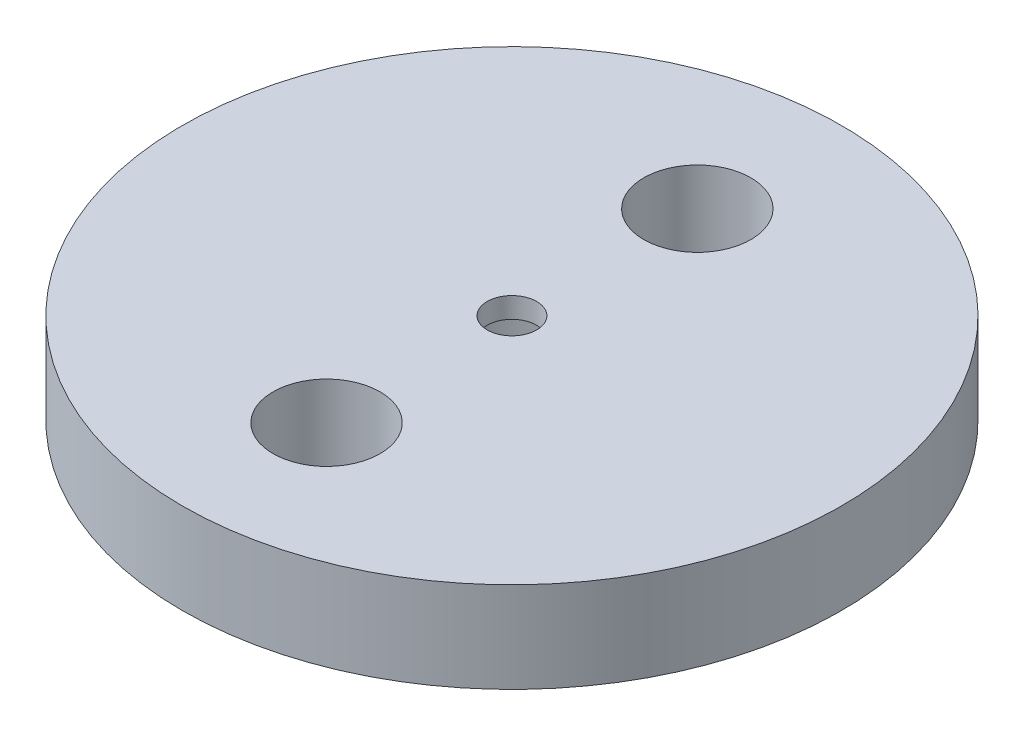
from build123d import *

# Parameters (mm, degrees)
SKETCH1_R           = 8
BOSS_EXTRUDE1_DEPTH = 2.2
SKETCH2_R           = 1.3
CUT_EXTRUDE1_DEPTH  = 2.2
SKETCH3_R           = 3
SKETCH3_R_2         = 2.45
BOSS_EXTRUDE2_DEPTH = 2.2
SKETCH8_R           = 0.6
CUT_EXTRUDE7_DEPTH  = 2.2
CUT_EXTRUDE8_START  = -1.7
SKETCH9_R           = 2.45
CUT_EXTRUDE8_DEPTH  = 1.7


with BuildPart() as part:
    # Sketch1 → Boss-Extrude1 (new body)
    with BuildSketch(Plane(origin=(0, 0, 0), x_dir=(1, 0, 0), z_dir=(0, 1, 0))):
        with Locations(Location((0, 0, 0), (0, 0, 270))):
            Circle(SKETCH1_R)
    extrude(amount=BOSS_EXTRUDE1_DEPTH)

    # Sketch2 → Cut-Extrude1 (cut)
    with BuildSketch(Plane(origin=(0, 2.2, 0), x_dir=(1, 0, 0), z_dir=(0, 1, 0))):
        with Locations(Location((0, 4.5, 0), (0, 0, 270))):
            Circle(SKETCH2_R)
        with Locations(Location((0, -4.5, 0), (0, 0, 90))):
            Circle(SKETCH2_R)
    extrude(amount=-CUT_EXTRUDE1_DEPTH, mode=Mode.SUBTRACT)

    # Sketch3 → Boss-Extrude2 (add)
    with BuildSketch(Plane.XZ):
        with Locations(Location((0, 0, 0), (0, 0, 90))):
            Circle(SKETCH3_R)
        with Locations(Location((0, 0, 0), (0, 0, 270))):
            Circle(SKETCH3_R_2, mode=Mode.SUBTRACT)
    extrude(amount=BOSS_EXTRUDE2_DEPTH)

    # Sketch8 → Cut-Extrude7 (cut)
    with BuildSketch(Plane.XZ):
        with Locations(Location((0, 0, 0), (0, 0, 270))):
            Circle(SKETCH8_R)
    extrude(amount=-CUT_EXTRUDE7_DEPTH, mode=Mode.SUBTRACT)

    # Sketch9 → Cut-Extrude8 (cut)
    with BuildSketch(Plane.XZ.offset(CUT_EXTRUDE8_START)):
        with Locations(Location((0, 0, 0), (0, 0, 270))):
            Circle(SKETCH9_R)
    extrude(amount=CUT_EXTRUDE8_DEPTH, mode=Mode.SUBTRACT)


solid = part.part
